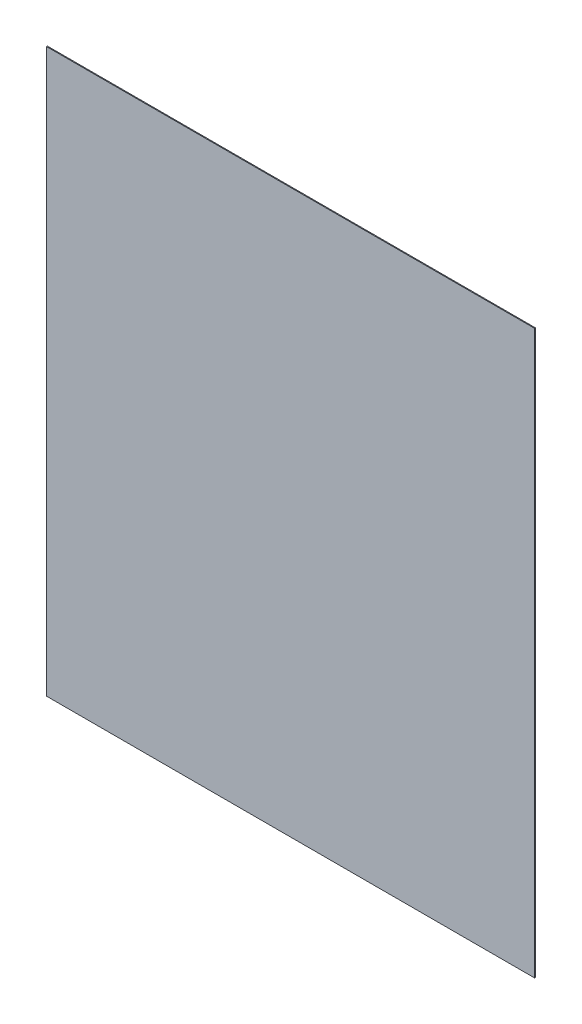
from build123d import *

# Parameters (mm, degrees)
CROQUIS1_W              = 500
CROQUIS1_H              = 576.2
SALIENTE_EXTRUIR1_DEPTH = 0.9


with BuildPart() as part:
    # Croquis1 → Saliente-Extruir1 (new body)
    with BuildSketch(Plane.XY):
        Rectangle(CROQUIS1_W, CROQUIS1_H)
    extrude(amount=SALIENTE_EXTRUIR1_DEPTH)


solid = part.part
